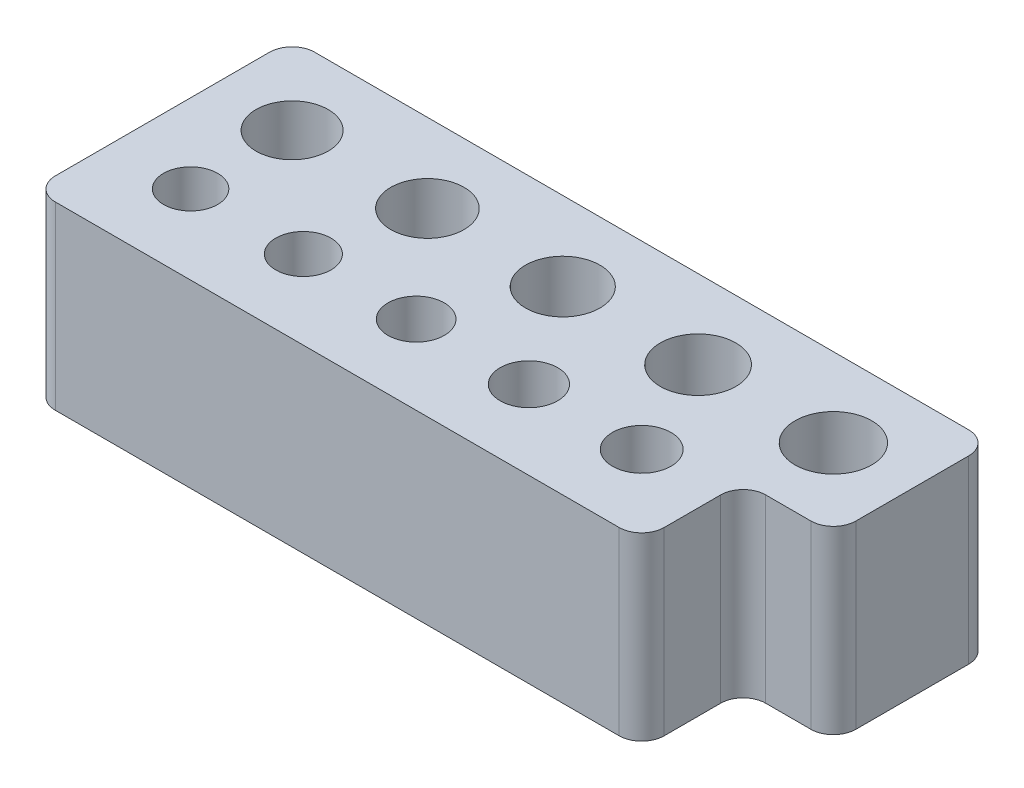
from build123d import *

# Parameters (mm, degrees)
SKETCH1_R           = 1.2
SKETCH1_R_2         = 1.225
SKETCH1_R_3         = 1.25
SKETCH1_R_4         = 1.275
SKETCH1_R_5         = 1.3
SKETCH1_R_6         = 1.6
SKETCH1_R_7         = 1.625
SKETCH1_R_8         = 1.65
SKETCH1_R_9         = 1.675
SKETCH1_R_10        = 1.7
BOSS_EXTRUDE1_DEPTH = 8
FILLET1_R           = 1


with BuildPart() as part:
    # Sketch1 → Boss-Extrude1 (new body)
    with BuildSketch(Plane(origin=(0, 0, 0), x_dir=(1, 0, 0), z_dir=(0, 1, 0))):
        Polygon((0, 0), (27, 0), (27, 4.5), (31, 4.5), (31, 11.5), (0, 11.5), align=None)
        with Locations(Location((3.5, 3.5, 0), (0, 0, 270))):
            Circle(SKETCH1_R, mode=Mode.SUBTRACT)
        with Locations(Location((8.5, 3.5, 0), (0, 0, 270))):
            Circle(SKETCH1_R_2, mode=Mode.SUBTRACT)
        with Locations(Location((13.5, 3.5, 0), (0, 0, 270))):
            Circle(SKETCH1_R_3, mode=Mode.SUBTRACT)
        with Locations(Location((18.5, 3.5, 0), (0, 0, 270))):
            Circle(SKETCH1_R_4, mode=Mode.SUBTRACT)
        with Locations(Location((23.5, 3.5, 0), (0, 0, 270))):
            Circle(SKETCH1_R_5, mode=Mode.SUBTRACT)
        with Locations(Location((3.5, 8, 0), (0, 0, 270))):
            Circle(SKETCH1_R_6, mode=Mode.SUBTRACT)
        with Locations(Location((9.5, 8, 0), (0, 0, 270))):
            Circle(SKETCH1_R_7, mode=Mode.SUBTRACT)
        with Locations(Location((15.5, 8, 0), (0, 0, 270))):
            Circle(SKETCH1_R_8, mode=Mode.SUBTRACT)
        with Locations(Location((21.5, 8, 0), (0, 0, 270))):
            Circle(SKETCH1_R_9, mode=Mode.SUBTRACT)
        with Locations(Location((27.5, 8, 0), (0, 0, 270))):
            Circle(SKETCH1_R_10, mode=Mode.SUBTRACT)
    extrude(amount=BOSS_EXTRUDE1_DEPTH)

    # Fillet1
    fillet1_edges = [part.edges().sort_by_distance(p)[0] for p in [
        (0, 4, -11.5),
        (31, 4, -11.5),
        (31, 4, -4.5),
        (27, 4, -4.5),
        (27, 4, 0),
        (0, 4, 0),
    ]]
    fillet(fillet1_edges, radius=FILLET1_R)


solid = part.part
